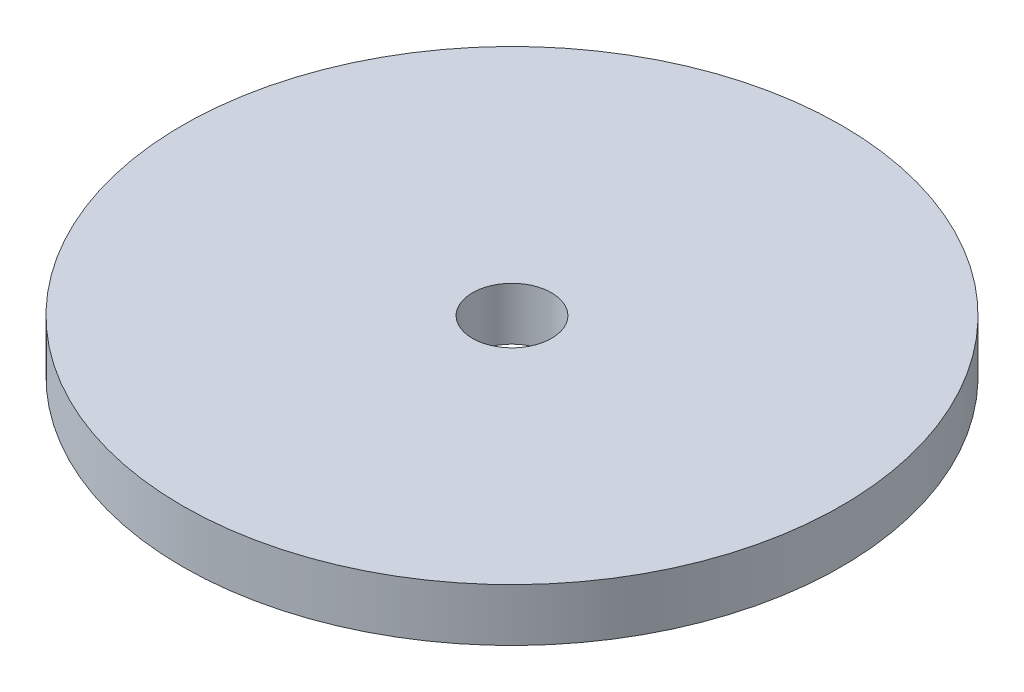
from build123d import *

# Parameters (mm, degrees)
SKETCH1_R           = 12.5
SKETCH1_R_2         = 1.5
BOSS_EXTRUDE1_DEPTH = 2


with BuildPart() as part:
    # Sketch1 → Boss-Extrude1 (new body)
    with BuildSketch(Plane(origin=(0, 0, 0), x_dir=(1, 0, 0), z_dir=(0, 1, 0))):
        with Locations(Location((0, 0, 0), (0, 0, 270))):
            Circle(SKETCH1_R)
        with Locations(Location((0, 0, 0), (0, 0, 270))):
            Circle(SKETCH1_R_2, mode=Mode.SUBTRACT)
    extrude(amount=BOSS_EXTRUDE1_DEPTH)


solid = part.part
